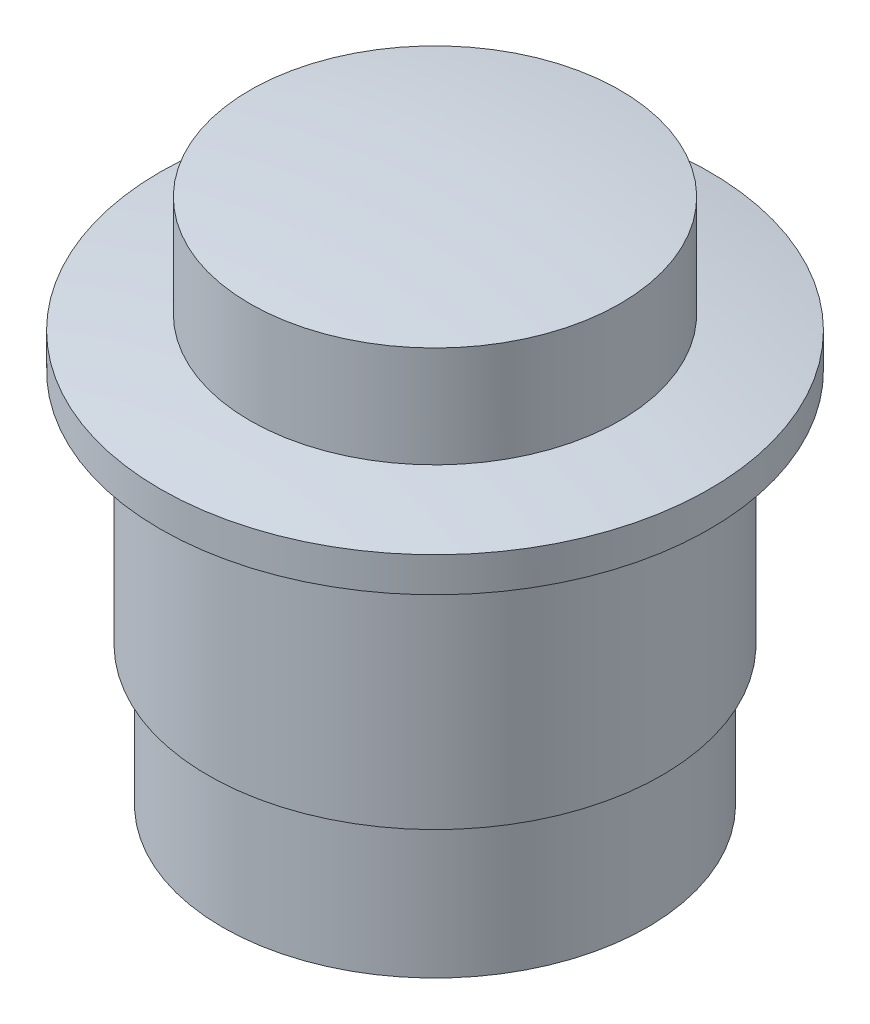
from build123d import *

# Parameters (mm, degrees)
SKETCH1_R           = 7.35
BOSS_EXTRUDE1_DEPTH = 4.8
SKETCH2_R           = 7.85
BOSS_EXTRUDE2_DEPTH = 8.2


with BuildPart() as part:
    # Sketch1 → Boss-Extrude1 (new body)
    with BuildSketch(Plane(origin=(0, 0, 0), x_dir=(1, 0, 0), z_dir=(0, 1, 0))):
        with Locations(Location((0, 0, 0), (0, 0, 270))):
            Circle(SKETCH1_R)
    extrude(amount=BOSS_EXTRUDE1_DEPTH)

    # Sketch2 → Boss-Extrude2 (add)
    with BuildSketch(Plane(origin=(0, 4.8, 0), x_dir=(1, 0, 0), z_dir=(0, 1, 0))):
        with Locations(Location((0, 0, 0), (0, 0, 90))):
            Circle(SKETCH2_R)
    extrude(amount=BOSS_EXTRUDE2_DEPTH)

    # Sketch3 → Revolve2 (revolve)
    with BuildSketch(Plane.XY, mode=Mode.PRIVATE) as revolve2_sk:
        with BuildLine():
            Line((0, 18.610795484), (0, 13))
            Line((0, 13), (-7.85, 13))
            Line((-7.85, 13), (-9.5, 13))
            Line((-9.5, 13), (-9.5, 14.2))
            ThreePointArc((-9.5, 14.2), (-7.953922053, 14.474092821), (-6.4, 14.699503876))
            Line((-6.4, 14.699503876), (-6.4, 18.199503876))
            ThreePointArc((-6.4, 18.199503876), (-3.206601035, 18.507866639), (0, 18.610795484))
        make_face()
    revolve(revolve2_sk.sketch.rotate(Axis((0, 15.200891001, 0), (0, -1, 0)), 270), axis=Axis((0, 15.200891001, 0), (0, -1, 0)))


solid = part.part
